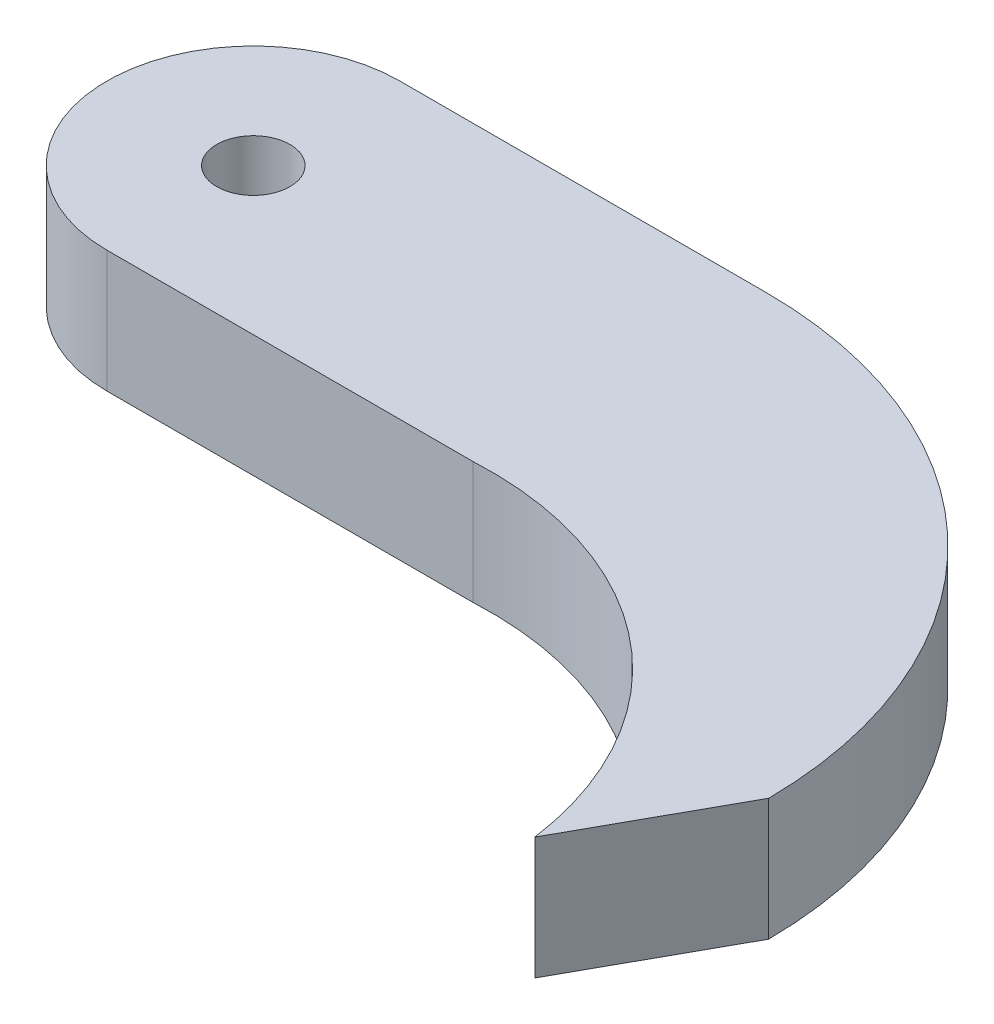
from build123d import *

# Parameters (mm, degrees)
SKETCH1_R           = 1.5
BOSS_EXTRUDE1_DEPTH = 5


with BuildPart() as part:
    # Sketch1 → Boss-Extrude1 (new body)
    with BuildSketch(Plane(origin=(0, 0, 0), x_dir=(1, 0, 0), z_dir=(0, 1, 0))):
        with BuildLine():
            Line((0, 6), (15, 6))
            ThreePointArc((15, 6), (27.689208405, 0.766518321), (32.999667954, -11.890667772))
            Line((32.999667954, -11.890667772), (29.587418813, -18.0559322))
            ThreePointArc((29.587418813, -18.0559322), (24.639204906, -9.189966963), (15, -6))
            Line((15, -6), (0, -6))
            ThreePointArc((0, -6), (-6, 0), (0, 6))
        make_face()
        with Locations(Location((0, 0, 0), (0, 0, 270))):
            Circle(SKETCH1_R, mode=Mode.SUBTRACT)
    extrude(amount=BOSS_EXTRUDE1_DEPTH)


solid = part.part
